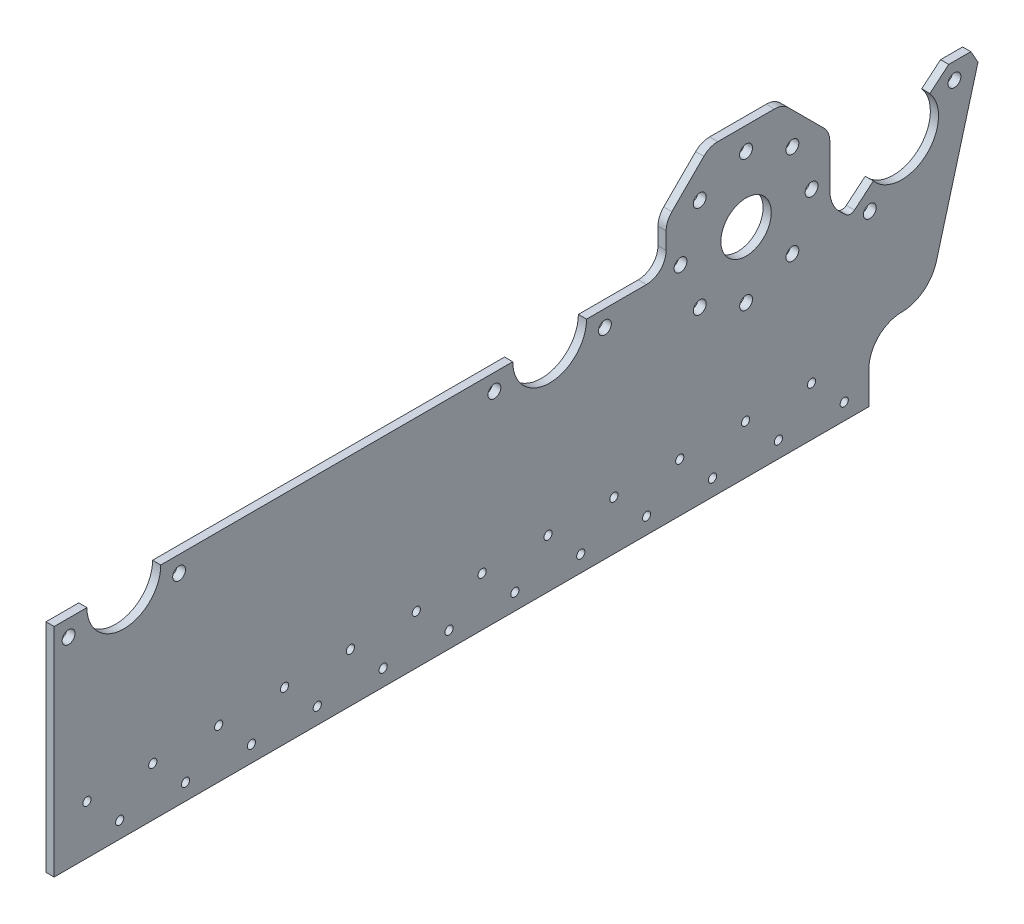
from build123d import *

# Parameters (mm, degrees)
SKETCH1_R                  = 9.779
SKETCH1_R_2                = 2.413
BOSS_EXTRUDE1_DEPTH        = 3.175
F_10_CLEARANCE_HOLE1_D     = 4.9784
F_10_CLEARANCE_HOLE2_D     = 4.9784
F_10_CLEARANCE_HOLE2_DEPTH = 3.175
F_10_CLEARANCE_HOLE2_TIP   = 1.495662253
CHAMFER1_SIZE              = 5.08
CHAMFER1_SIZE2             = 4.1342197
FILLET1_R                  = 7.62
SKETCH7_R                  = 1.5875
CUT_EXTRUDE1_DEPTH         = 346.209763321


with BuildPart() as part:
    # Sketch1 → Boss-Extrude1 (new body)
    with BuildSketch(Plane(origin=(0, 0, 0), x_dir=(0, 0, -1), z_dir=(1, 0, 0))):
        with BuildLine():
            Line((-12.7, -12.7), (-328.6379, -12.7))
            Line((-328.6379, -12.7), (-328.6379, 71.4629))
            Line((-328.6379, 71.4629), (-315.9379, 71.4629))
            ThreePointArc((-315.9379, 71.4629), (-301.625, 57.15), (-287.3121, 71.4629))
            Line((-287.3121, 71.4629), (-150.8125, 71.4629))
            ThreePointArc((-150.8125, 71.4629), (-136.4996, 57.15), (-122.1867, 71.4629))
            Line((-122.1867, 71.4629), (-91.313, 71.4629))
            Line((-91.313, 71.4629), (-91.313, 88.788677931))
            Line((-91.313, 88.788677931), (-74.475777931, 105.6259))
            Line((-74.475777931, 105.6259), (-46.174222069, 105.6259))
            Line((-46.174222069, 105.6259), (-27.855333333, 87.307011265))
            Line((-27.855333333, 87.307011265), (-27.855333333, 67.615437998))
            ThreePointArc((-27.855333333, 67.615437998), (-26.836905275, 62.632379001), (-23.944959008, 58.448514823))
            Line((-23.944959008, 58.448514823), (-21.653228214, 56.251108404))
            ThreePointArc((-21.653228214, 56.251108404), (-19.979435171, 55.545886769), (-18.262622551, 56.138740153))
            Line((-18.262622551, 56.138740153), (-10.96431751, 62.262745221))
            ThreePointArc((-10.96431751, 62.262745221), (9.200154779, 60.49858249), (10.96431751, 80.663054779))
            Line((10.96431751, 80.663054779), (18.262622551, 86.787059847))
            Line((18.262622551, 86.787059847), (30.962622551, 86.787059847))
            Line((30.962622551, 86.787059847), (13.473085073, 22.977185543))
            ThreePointArc((13.473085073, 22.977185543), (8.472670241, 15.562580904), (0, 12.7))
            ThreePointArc((0, 12.7), (-8.980256121, 8.980256121), (-12.7, 0))
            Line((-12.7, 0), (-12.7, -12.7))
        make_face()
        with Locations((-60.325, 71.4629)):
            Circle(SKETCH1_R, mode=Mode.SUBTRACT)
        with Locations((-60.325, 96.8629)):
            Circle(SKETCH1_R_2, mode=Mode.SUBTRACT)
        with Locations((-42.364487758, 89.423412242)):
            Circle(SKETCH1_R_2, mode=Mode.SUBTRACT)
        with Locations((-34.925, 71.4629)):
            Circle(SKETCH1_R_2, mode=Mode.SUBTRACT)
        with Locations((-42.364487758, 53.502387758)):
            Circle(SKETCH1_R_2, mode=Mode.SUBTRACT)
        with Locations((-60.325, 46.0629)):
            Circle(SKETCH1_R_2, mode=Mode.SUBTRACT)
        with Locations((-78.285512242, 53.502387758)):
            Circle(SKETCH1_R_2, mode=Mode.SUBTRACT)
        with Locations((-85.725, 71.4629)):
            Circle(SKETCH1_R_2, mode=Mode.SUBTRACT)
        with Locations((-78.285512242, 89.423412242)):
            Circle(SKETCH1_R_2, mode=Mode.SUBTRACT)
    extrude(amount=BOSS_EXTRUDE1_DEPTH)

    # #10 Clearance Hole1 (through all)
    with Locations(Plane(origin=(3.175, 0, 0), x_dir=(0, 0, -1), z_dir=(1, 0, 0))):
        with Locations((-323.05625, 65.1129), (-280.19375, 65.1129), (-157.93085, 65.1129), (-115.06835, 65.1129), (-12.33558865, 52.822775826), (20.498991293, 80.374259746)):
            Hole(F_10_CLEARANCE_HOLE1_D / 2)

    # #10 Clearance Hole2
    with Locations(Plane(origin=(3.175, 0, 0), x_dir=(0, 0, -1), z_dir=(1, 0, 0))):
        with Locations((-60.325, 96.8629), (-42.364487758, 89.423412242), (-34.925, 71.4629), (-42.364487758, 53.502387758), (-60.325, 46.0629), (-78.285512242, 53.502387758), (-85.725, 71.4629), (-78.285512242, 89.423412242)):
            Hole(F_10_CLEARANCE_HOLE2_D / 2, depth=F_10_CLEARANCE_HOLE2_DEPTH)
            with Locations((0, 0, -(F_10_CLEARANCE_HOLE2_DEPTH + F_10_CLEARANCE_HOLE2_TIP / 2))):  # 118° drill point
                Cone(0, F_10_CLEARANCE_HOLE2_D / 2, F_10_CLEARANCE_HOLE2_TIP, mode=Mode.SUBTRACT)

    # Chamfer1
    chamfer1_edges = [part.edges().sort_by_distance(p)[0] for p in [
        (1.5875, 86.787059847, -30.962622551),
    ]]
    chamfer1_side = [part.faces().sort_by_distance(p)[0] for p in [
        (1.5875, 54.882122695, -22.217853812),
    ]]
    chamfer(chamfer1_edges, length=CHAMFER1_SIZE, length2=CHAMFER1_SIZE2, reference=chamfer1_side[0])

    # Fillet1
    fillet1_edges = [part.edges().sort_by_distance(p)[0] for p in [
        (1.5875, 71.4629, 91.313),
        (1.5875, 88.788677931, 91.313),
        (1.5875, 105.6259, 74.475777931),
        (1.5875, 105.6259, 46.174222069),
        (1.5875, 87.307011265, 27.855333333),
    ]]
    fillet(fillet1_edges, radius=FILLET1_R)

    # Sketch7 → Cut-Extrude1 (cut, through all)
    with BuildSketch(Plane.ZY):
        with Locations((315.9379, 6.35)):
            Circle(SKETCH7_R)
        with Locations((303.2379, -6.35)):
            Circle(SKETCH7_R)
        with Locations((290.393581818, 6.35)):
            Circle(SKETCH7_R)
        with Locations((277.693581818, -6.35)):
            Circle(SKETCH7_R)
        with Locations((264.849263636, 6.35)):
            Circle(SKETCH7_R)
        with Locations((252.149263636, -6.35)):
            Circle(SKETCH7_R)
        with Locations((239.304945455, 6.35)):
            Circle(SKETCH7_R)
        with Locations((226.604945455, -6.35)):
            Circle(SKETCH7_R)
        with Locations((213.760627273, 6.35)):
            Circle(SKETCH7_R)
        with Locations((201.060627273, -6.35)):
            Circle(SKETCH7_R)
        with Locations((188.216309091, 6.35)):
            Circle(SKETCH7_R)
        with Locations((175.516309091, -6.35)):
            Circle(SKETCH7_R)
        with Locations((162.671990909, 6.35)):
            Circle(SKETCH7_R)
        with Locations((149.971990909, -6.35)):
            Circle(SKETCH7_R)
        with Locations((137.127672727, 6.35)):
            Circle(SKETCH7_R)
        with Locations((124.427672727, -6.35)):
            Circle(SKETCH7_R)
        with Locations((111.583354545, 6.35)):
            Circle(SKETCH7_R)
        with Locations((98.883354545, -6.35)):
            Circle(SKETCH7_R)
        with Locations((86.039036364, 6.35)):
            Circle(SKETCH7_R)
        with Locations((73.339036364, -6.35)):
            Circle(SKETCH7_R)
        with Locations((60.494718182, 6.35)):
            Circle(SKETCH7_R)
        with Locations((47.794718182, -6.35)):
            Circle(SKETCH7_R)
        with Locations((34.9504, 6.35)):
            Circle(SKETCH7_R)
        with Locations((22.2504, -6.35)):
            Circle(SKETCH7_R)
    extrude(amount=-CUT_EXTRUDE1_DEPTH, mode=Mode.SUBTRACT)


solid = part.part
